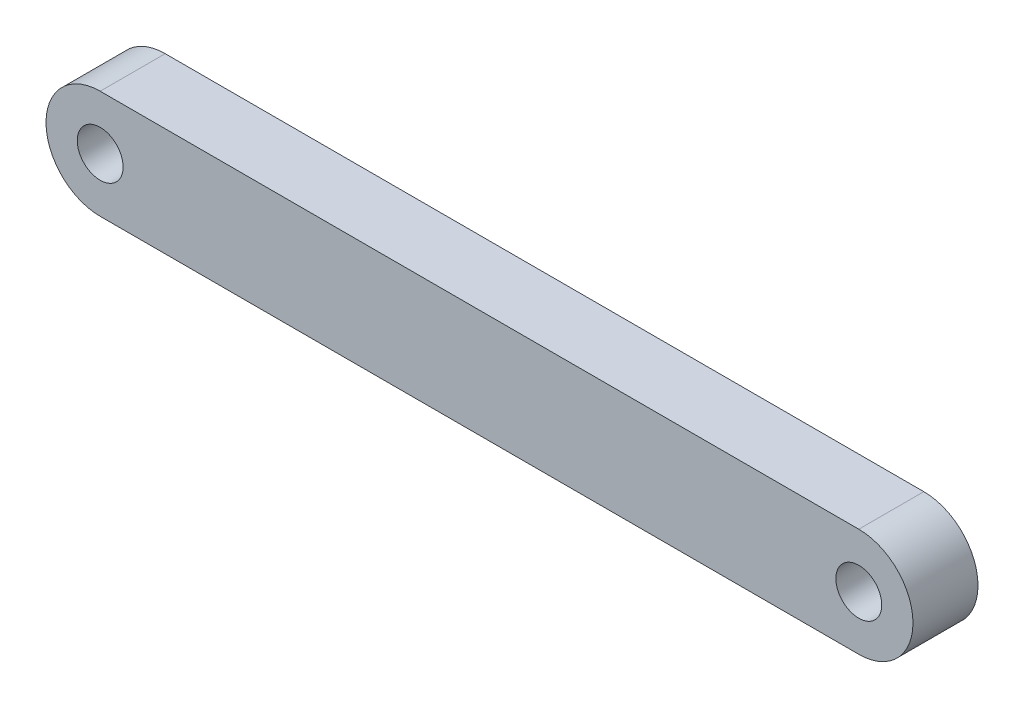
from build123d import *

# Parameters (mm, degrees)
SKETCH1_R           = 3.175
BOSS_EXTRUDE1_DEPTH = 4.5


with BuildPart() as part:
    # Sketch1 → Boss-Extrude1 (new, symmetric)
    with BuildSketch(Plane.XY):
        with BuildLine():
            Line((-52.5, 7.5), (52.5, 7.5))
            ThreePointArc((52.5, 7.5), (60, 0), (52.5, -7.5))
            Line((52.5, -7.5), (-52.5, -7.5))
            ThreePointArc((-52.5, -7.5), (-60, 0), (-52.5, 7.5))
        make_face()
        with Locations((52.5, 0)):
            Circle(SKETCH1_R, mode=Mode.SUBTRACT)
        with Locations((-52.5, 0)):
            Circle(SKETCH1_R, mode=Mode.SUBTRACT)
    extrude(amount=BOSS_EXTRUDE1_DEPTH, both=True)


solid = part.part
